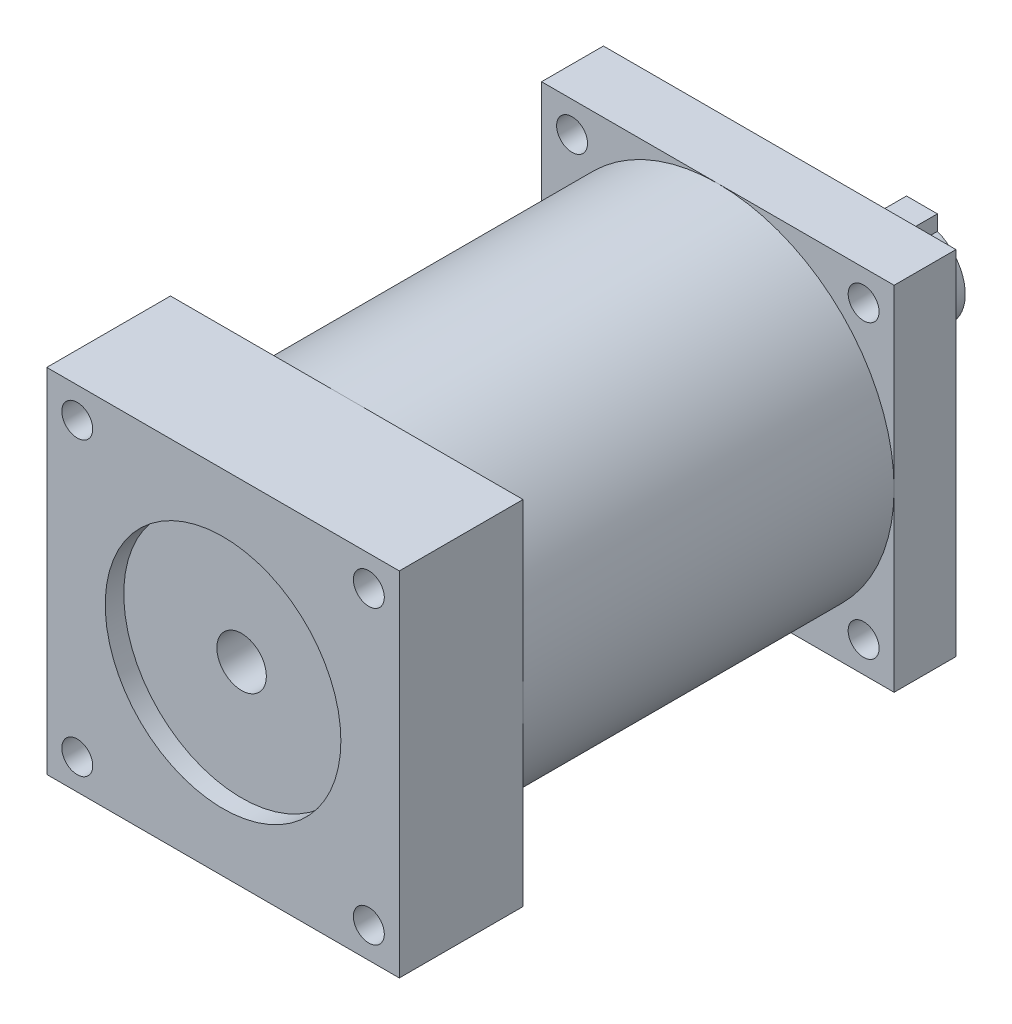
from build123d import *

# Parameters (mm, degrees)
SKETCH_1_W               = 57
SKETCH_1_H               = 57
SKETCH_1_R               = 2.5
EXTRUDE_1_DEPTH          = 90
CUT_EXTRUDE_1_DEPTH      = 35
CUT_EXTRUDE_1_DEPTH_BACK = 25
SKETCH_2_W               = 108.428047284
SKETCH_2_H               = 112.732753546
SKETCH_2_R               = 28.5
SKETCH_3_R               = 21
EXTRUDE_2_DEPTH          = 3
SKETCH_4_R               = 7
EXTRUDE_3_DEPTH          = 20
SKETCH_5_R               = 4
CUT_EXTRUDE_2_DEPTH      = 26
SKETCH_6_R               = 19.05
CUT_EXTRUDE_3_DEPTH      = 3
EXTRUDE_4_DEPTH          = 18


with BuildPart() as part:
    # 草图1 → 凸台-拉伸1 (new body)
    with BuildSketch(Plane.XY):
        Rectangle(SKETCH_1_W, SKETCH_1_H)
        with Locations(Location((-23.57, 23.57, 0), (0, 0, 180))):
            Circle(SKETCH_1_R, mode=Mode.SUBTRACT)
        with Locations(Location((23.57, 23.57, 0), (0, 0, 180))):
            Circle(SKETCH_1_R, mode=Mode.SUBTRACT)
        with Locations(Location((23.57, -23.57, 0), (0, 0, 180))):
            Circle(SKETCH_1_R, mode=Mode.SUBTRACT)
        with Locations(Location((-23.57, -23.57, 0), (0, 0, 180))):
            Circle(SKETCH_1_R, mode=Mode.SUBTRACT)
    extrude(amount=EXTRUDE_1_DEPTH)

    # 草图2 → 切除-拉伸1 (cut, two sides: drawn at the far end of the back side and taken through both)
    with BuildSketch(Plane(origin=(0, 0, 45), x_dir=(-1, 0, 0), z_dir=(0, 0, -1)).offset(-CUT_EXTRUDE_1_DEPTH_BACK)):
        Rectangle(SKETCH_2_W, SKETCH_2_H)
        with Locations(Location((0, 0, 0), (0, 0, 180))):
            Circle(SKETCH_2_R, mode=Mode.SUBTRACT)
    extrude(amount=CUT_EXTRUDE_1_DEPTH + CUT_EXTRUDE_1_DEPTH_BACK, mode=Mode.SUBTRACT)

    # 草图3 → 凸台-拉伸2 (add)
    with BuildSketch(Plane(origin=(0, 0, 0), x_dir=(-1, 0, 0), z_dir=(0, 0, -1))):
        Circle(SKETCH_3_R)
    extrude(amount=EXTRUDE_2_DEPTH)

    # 草图4 → 凸台-拉伸3 (add)
    with BuildSketch(Plane(origin=(0, 0, -3), x_dir=(-1, 0, 0), z_dir=(0, 0, -1))):
        Circle(SKETCH_4_R)
    extrude(amount=EXTRUDE_3_DEPTH)

    # 草图5 → 切除-拉伸2 (cut)
    with BuildSketch(Plane.XY.offset(90)):
        Circle(SKETCH_5_R)
    extrude(amount=-CUT_EXTRUDE_2_DEPTH, mode=Mode.SUBTRACT)

    # 草图6 → 切除-拉伸3 (cut)
    with BuildSketch(Plane.XY.offset(90)):
        Circle(SKETCH_6_R)
    extrude(amount=-CUT_EXTRUDE_3_DEPTH, mode=Mode.SUBTRACT)

    # 草图7 → 凸台-拉伸4 (add)
    with BuildSketch(Plane(origin=(0, 0, -23), x_dir=(-1, 0, 0), z_dir=(0, 0, -1))):
        Polygon((0, 9), (2.5, 9), (2.5, 0), (-2.5, 0), (-2.5, 9), align=None)
    extrude(amount=-EXTRUDE_4_DEPTH)


solid = part.part
